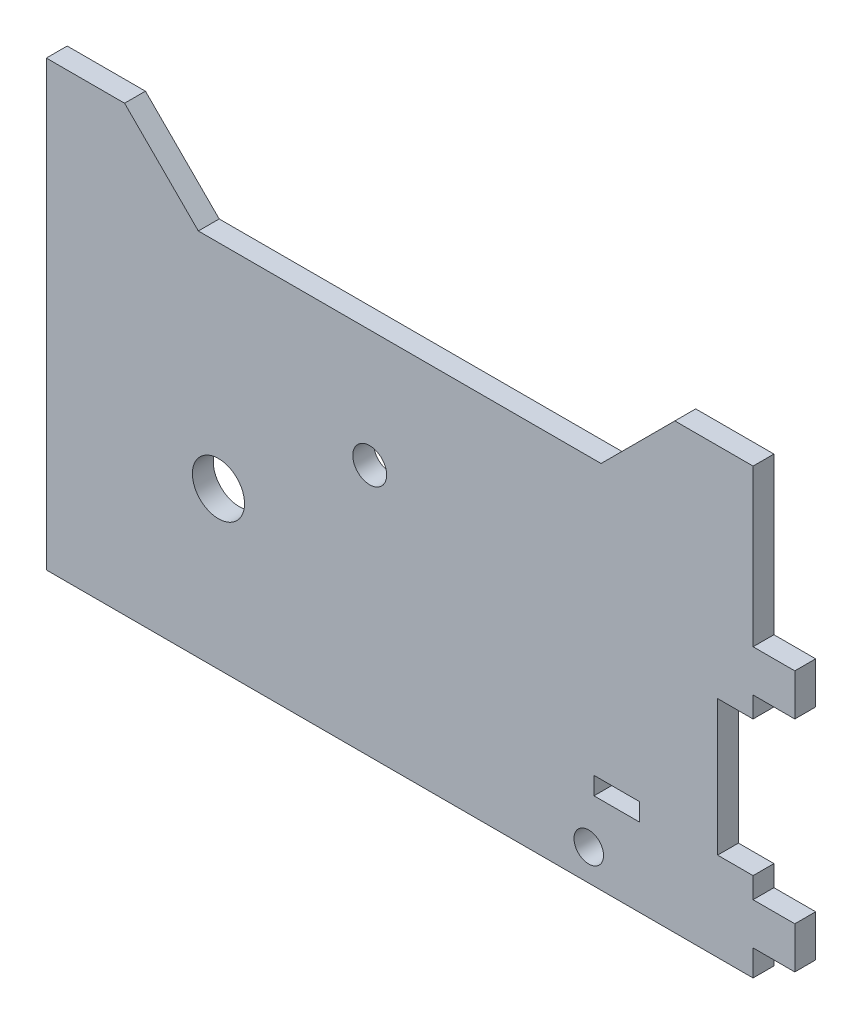
from build123d import *

# Parameters (mm, degrees)
SKETCH1_R           = 5
SKETCH1_R_2         = 2.83
SKETCH1_R_3         = 3.25
SKETCH1_W           = 8.7
SKETCH1_H           = 3.4
BOSS_EXTRUDE1_DEPTH = 4
BOSS_EXTRUDE2_DEPTH = 4


with BuildPart() as part:
    # Sketch1 → Boss-Extrude1 (new body)
    with BuildSketch(Plane.XY):
        Polygon((49, 30), (56.5, 30), (56.5, 25), (64.5, 25), (64.5, 17), (56.5, 17), (56.5, 13), (49.7, 13), (49.7, -13), (56.5, -13), (56.5, -17), (64.5, -17), (64.5, -25), (56.5, -25), (56.5, -30), (49, -30), (-79, -30), (-79, 30), align=None)
        with Locations((-46, 0)):
            Circle(SKETCH1_R, mode=Mode.SUBTRACT)
        with Locations((25, -24)):
            Circle(SKETCH1_R_2, mode=Mode.SUBTRACT)
        with Locations((-17, 18.39610675)):
            Circle(SKETCH1_R_3, mode=Mode.SUBTRACT)
        with Locations((30.35, -13.3)):
            Rectangle(SKETCH1_W, SKETCH1_H, mode=Mode.SUBTRACT)
    extrude(amount=BOSS_EXTRUDE1_DEPTH)

    # Sketch2 → Boss-Extrude2 (add)
    with BuildSketch(Plane.XY):
        Polygon((-79, 30), (56.5, 30), (56.5, 55), (41.5, 55), (27.357864376, 40.857864376), (-49.857864376, 40.857864376), (-64, 55), (-79, 55), align=None)
    extrude(amount=BOSS_EXTRUDE2_DEPTH)


solid = part.part
